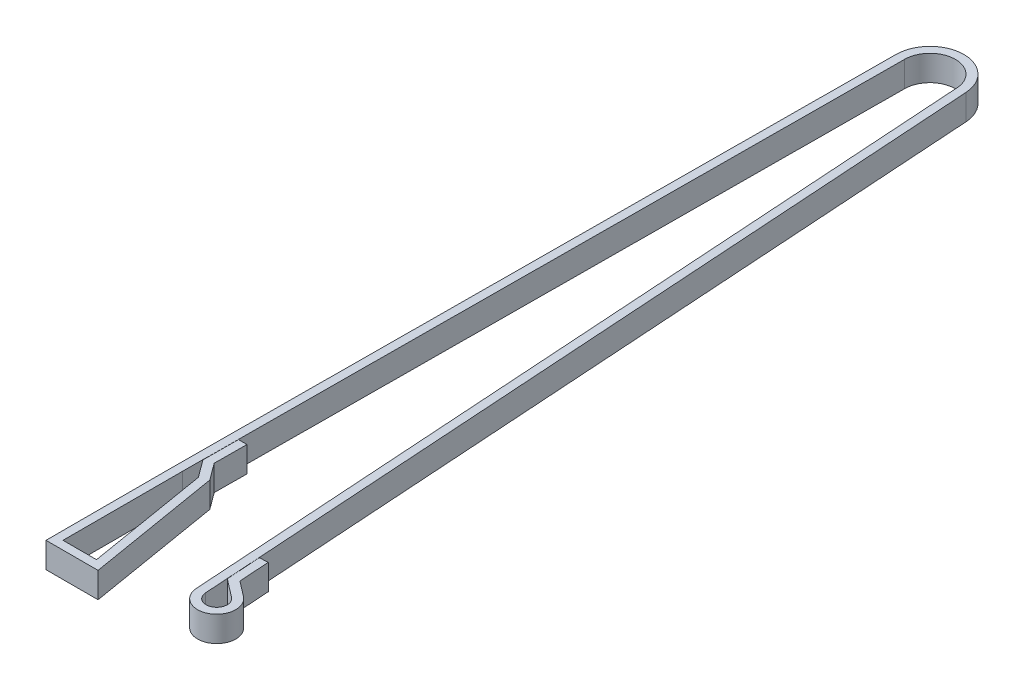
from build123d import *

# Parameters (mm, degrees)
EXTRUDE_THIN3_DEPTH = 3


with BuildPart() as part:
    # Sketch1 → Extrude-Thin3 (new, symmetric)
    with BuildSketch(Plane(origin=(0, 0, 0), x_dir=(1, 0, 0), z_dir=(0, 1, 0))):
        with BuildLine():
            Line((1.127012176, 13.013546351), (1.077715548, 4.681395496))
            Line((1.077715548, 4.681395496), (4.100420922, 0.582923517))
            Line((4.100420922, 0.582923517), (8.897574841, -28.2))
            Line((8.897574841, -28.2), (1, -28.2))
            Line((1, -28.2), (1, -0.002958192))
            Line((1, -0.002958192), (2.00010501, 169.035497988))
            ThreePointArc((2.00010501, 169.035497988), (7.822069743, 174.997361155), (13.987237653, 169.39113333))
            Line((13.987237653, 169.39113333), (26.50957176, -22.293349997))
            ThreePointArc((26.50957176, -22.293349997), (33.11993484, -25.969367239), (33.741089124, -18.431186413))
            Line((33.741089124, -18.431186413), (30.134955883, -15.661433283))
            Line((30.134955883, -15.661433283), (29.667792354, -8.510370309))
            Line((29.667792354, -8.510370309), (27.672046469, -8.640748086))
            Line((27.672046469, -8.640748086), (28.198263672, -16.695769752))
            Line((28.198263672, -16.695769752), (32.522827291, -20.017325785))
            ThreePointArc((32.522827291, -20.017325785), (32.177741578, -24.205204022), (28.505317644, -22.162972221))
            Line((28.505317644, -22.162972221), (15.982983538, 169.521511107))
            ThreePointArc((15.982983538, 169.521511107), (7.762759658, 176.99648154), (0.000140013, 169.04733065))
            Line((0.000140013, 169.04733065), (-1, 0.002958192))
            Line((-1, 0.002958192), (-1, -30.2))
            Line((-1, -30.2), (11.258495684, -30.2))
            Line((11.258495684, -30.2), (5.994431581, 1.384384622))
            Line((5.994431581, 1.384384622), (3.081610843, 5.333864542))
            Line((3.081610843, 5.333864542), (3.126977173, 13.001713688))
            Line((3.126977173, 13.001713688), (1.127012176, 13.013546351))
        make_face()
    extrude(amount=EXTRUDE_THIN3_DEPTH, both=True)


solid = part.part
